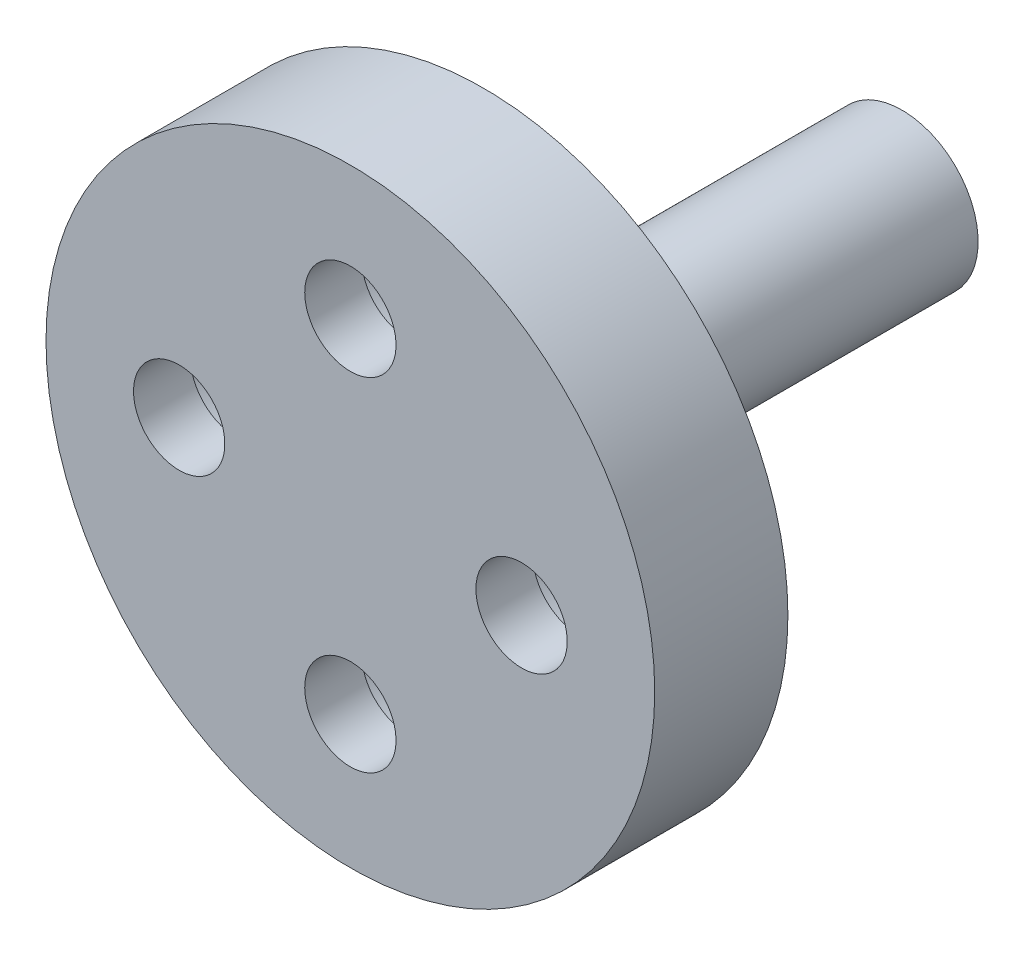
from build123d import *

# Parameters (mm, degrees)
CBORE_FOR_M2_SHCS1_AT_2_COUNT = 2
CBORE_FOR_M2_SHCS1_AT_2_PITCH = 6.363961031
CBORE_FOR_M2_SHCS1_AT_3_COUNT = 2
CBORE_FOR_M2_SHCS1_AT_3_PITCH = 9
CBORE_FOR_M2_SHCS1_AT_4_COUNT = 2
CBORE_FOR_M2_SHCS1_AT_4_PITCH = 6.363961031


with BuildPart() as part:
    # Sketch2 → Revolve1 (revolve)
    with BuildSketch(Plane(origin=(0, 0, 0), x_dir=(1, 0, 0), z_dir=(0, 1, 0)), mode=Mode.PRIVATE) as revolve1_sk:
        Polygon((0, 0), (8, 0), (8, 3.5), (2, 3.5), (2, 14.5), (0, 14.5), align=None)
    revolve(revolve1_sk.sketch.rotate(Axis((0, 0, -14.5), (0, 0, 1)), 180), axis=Axis((0, 0, -14.5), (0, 0, 1)))

    # Sketch5 → CBORE for M2 SHCS1 (revolve, cut)
    with BuildSketch(Plane(origin=(0, 4.5, -3.5), x_dir=(0, 1, 0), z_dir=(1, 0, 0))):
        Polygon((0, 0), (0, 3.5), (1.2, 3.5), (1.2, 2), (2.2, 2), (2.2, 0.020977491), (2.225, 0), align=None)
    cbore_for_m2_shcs1 = revolve(axis=Axis((0, 4.5, -9.85), (0, 0, 1)), mode=Mode.SUBTRACT)

    # CBORE for M2 SHCS1 at 2: CBORE for M2 SHCS1 ×2
    with Locations(*[Vector(-0.7071067811865476, -0.7071067811865476, 0) * (i * CBORE_FOR_M2_SHCS1_AT_2_PITCH) for i in range(1, CBORE_FOR_M2_SHCS1_AT_2_COUNT)]):
        add(cbore_for_m2_shcs1, mode=Mode.SUBTRACT)

    # CBORE for M2 SHCS1 at 3: CBORE for M2 SHCS1 ×2
    with Locations(*[(0, -i * CBORE_FOR_M2_SHCS1_AT_3_PITCH, 0) for i in range(1, CBORE_FOR_M2_SHCS1_AT_3_COUNT)]):
        add(cbore_for_m2_shcs1, mode=Mode.SUBTRACT)

    # CBORE for M2 SHCS1 at 4: CBORE for M2 SHCS1 ×2
    with Locations(*[Vector(0.7071067811865476, -0.7071067811865476, 0) * (i * CBORE_FOR_M2_SHCS1_AT_4_PITCH) for i in range(1, CBORE_FOR_M2_SHCS1_AT_4_COUNT)]):
        add(cbore_for_m2_shcs1, mode=Mode.SUBTRACT)


solid = part.part
